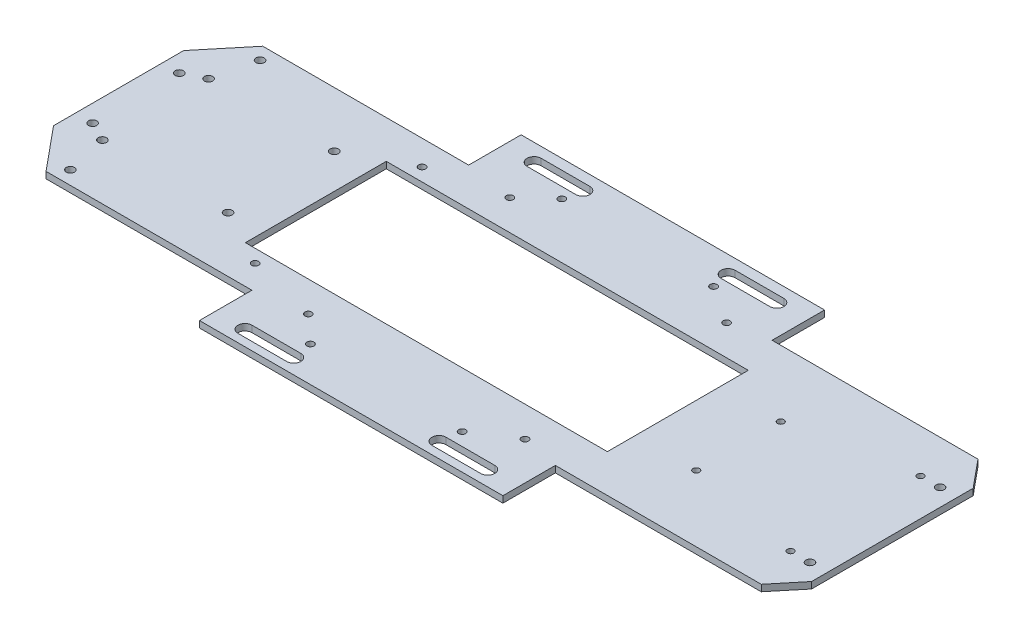
from build123d import *

# Parameters (mm, degrees)
SKETCH1_R               = 1.6
SKETCH1_W               = 167
SKETCH1_H               = 65
BOSS_EXTRUDE1_DEPTH     = 3
CUT_EXTRUDE1_DEPTH      = 197.104283482
CUT_EXTRUDE1_DEPTH_BACK = 197.104283482
SKETCH2_R               = 1.9
SKETCH2_W               = 13.670656581
SKETCH2_H               = 96.241422334
SKETCH3_R               = 1.9
CUT_EXTRUDE4_DEPTH      = 10
SKETCH7_R               = 1.5
CUT_EXTRUDE5_DEPTH      = 10
STAND_MOUNT_HOLES_DEPTH = 197.104283482


with BuildPart() as part:
    # Sketch1 → Boss-Extrude1 (new body)
    with BuildSketch(Plane(origin=(0, 0, 0), x_dir=(1, 0, 0), z_dir=(0, 1, 0))):
        Polygon((181.5, -30), (165, -50), (70, -50), (70, -74.2), (-70, -74.2), (-70, -50), (-165, -50), (-181.5, -30), (-181.5, 30), (-165, 50), (-70, 50), (-70, 74.2), (70, 74.2), (70, 50), (165, 50), (181.5, 30), align=None)
        with Locations(Location((-35, -58, 0), (0, 0, 270))):
            Circle(SKETCH1_R, mode=Mode.SUBTRACT)
        with Locations(Location((-35, 58, 0), (0, 0, 270))):
            Circle(SKETCH1_R, mode=Mode.SUBTRACT)
        with Locations(Location((35, 58, 0), (0, 0, 270))):
            Circle(SKETCH1_R, mode=Mode.SUBTRACT)
        with Locations(Location((35, -58, 0), (0, 0, 270))):
            Circle(SKETCH1_R, mode=Mode.SUBTRACT)
        with Locations(Location((-80, 38.5, 0), (0, 0, 270))):
            Circle(SKETCH1_R, mode=Mode.SUBTRACT)
        with Locations(Location((-80, -38.5, 0), (0, 0, 270))):
            Circle(SKETCH1_R, mode=Mode.SUBTRACT)
        with Locations(Location((-47.5, 46.5, 0), (0, 0, 270))):
            Circle(SKETCH1_R, mode=Mode.SUBTRACT)
        with Locations(Location((52.5, 46.5, 0), (0, 0, 270))):
            Circle(SKETCH1_R, mode=Mode.SUBTRACT)
        with Locations(Location((52.5, -46.5, 0), (0, 0, 270))):
            Circle(SKETCH1_R, mode=Mode.SUBTRACT)
        with Locations(Location((-47.5, -46.5, 0), (0, 0, 270))):
            Circle(SKETCH1_R, mode=Mode.SUBTRACT)
        with Locations((-7, 0)):
            Rectangle(SKETCH1_W, SKETCH1_H, mode=Mode.SUBTRACT)
    extrude(amount=BOSS_EXTRUDE1_DEPTH)

    # Sketch2 → Cut-Extrude1 (cut, two sides: drawn at the far end of the back side and taken through both)
    with BuildSketch(Plane(origin=(0, 3, 0), x_dir=(1, 0, 0), z_dir=(0, 1, 0)).offset(-CUT_EXTRUDE1_DEPTH_BACK)):
        with Locations(Location((167.5, -30, 0), (0, 0, 270))):
            Circle(SKETCH2_R)
        with Locations(Location((167.5, 30, 0), (0, 0, 270))):
            Circle(SKETCH2_R)
        with Locations(Location((-173.5, 20, 0), (0, 0, 270))):
            Circle(SKETCH2_R)
        with Locations(Location((-173.5, -20, 0), (0, 0, 270))):
            Circle(SKETCH2_R)
        with Locations((182.335328291, -4.374610106)):
            Rectangle(SKETCH2_W, SKETCH2_H)
    extrude(amount=CUT_EXTRUDE1_DEPTH + CUT_EXTRUDE1_DEPTH_BACK, mode=Mode.SUBTRACT)

    # Sketch3 → Cut-Extrude4 (cut)
    with BuildSketch(Plane(origin=(0, 3, 0), x_dir=(1, 0, 0), z_dir=(0, 1, 0))):
        with Locations(Location((-164.5, 24.5, 0), (0, 0, 270))):
            Circle(SKETCH3_R)
        with Locations(Location((-106.5, 24.5, 0), (0, 0, 270))):
            Circle(SKETCH3_R)
        with Locations(Location((-106.5, -24.5, 0), (0, 0, 270))):
            Circle(SKETCH3_R)
        with Locations(Location((-164.5, -24.5, 0), (0, 0, 270))):
            Circle(SKETCH3_R)
        with Locations(Location((-160, 43.75, 0), (0, 0, 270))):
            Circle(SKETCH3_R)
        with Locations(Location((-160, -43.75, 0), (0, 0, 270))):
            Circle(SKETCH3_R)
    extrude(amount=-CUT_EXTRUDE4_DEPTH, mode=Mode.SUBTRACT)

    # Sketch7 → Cut-Extrude5 (cut)
    with BuildSketch(Plane(origin=(0, 3, 0), x_dir=(1, 0, 0), z_dir=(0, 1, 0))):
        with Locations(Location((104.5, 19.5, 0), (0, 0, 270))):
            Circle(SKETCH7_R)
        with Locations(Location((158.5, 30, 0), (0, 0, 270))):
            Circle(SKETCH7_R)
        with Locations(Location((158.5, -30, 0), (0, 0, 270))):
            Circle(SKETCH7_R)
        with Locations(Location((104.5, -19.5, 0), (0, 0, 270))):
            Circle(SKETCH7_R)
    extrude(amount=-CUT_EXTRUDE5_DEPTH, mode=Mode.SUBTRACT)

    # Sketch8 → Stand mount holes (cut, through all)
    with BuildSketch(Plane(origin=(0, 3, 0), x_dir=(1, 0, 0), z_dir=(0, 1, 0))):
        with BuildLine():
            Line((-56, -63.95), (-33.5, -63.95))
            ThreePointArc((-33.5, -63.95), (-30.25, -67.2), (-33.5, -70.45))
            Line((-33.5, -70.45), (-56, -70.45))
            ThreePointArc((-56, -70.45), (-59.25, -67.2), (-56, -63.95))
        make_face()
        with BuildLine():
            Line((33.5, -63.95), (56, -63.95))
            ThreePointArc((56, -63.95), (59.25, -67.2), (56, -70.45))
            Line((56, -70.45), (33.5, -70.45))
            ThreePointArc((33.5, -70.45), (30.25, -67.2), (33.5, -63.95))
        make_face()
        with BuildLine():
            Line((-56, 69.45), (-33.5, 69.45))
            ThreePointArc((-33.5, 69.45), (-30.25, 66.2), (-33.5, 62.95))
            Line((-33.5, 62.95), (-56, 62.95))
            ThreePointArc((-56, 62.95), (-59.25, 66.2), (-56, 69.45))
        make_face()
        with BuildLine():
            Line((33.5, 69.45), (56, 69.45))
            ThreePointArc((56, 69.45), (59.25, 66.2), (56, 62.95))
            Line((56, 62.95), (33.5, 62.95))
            ThreePointArc((33.5, 62.95), (30.25, 66.2), (33.5, 69.45))
        make_face()
    extrude(amount=-STAND_MOUNT_HOLES_DEPTH, mode=Mode.SUBTRACT)


solid = part.part
